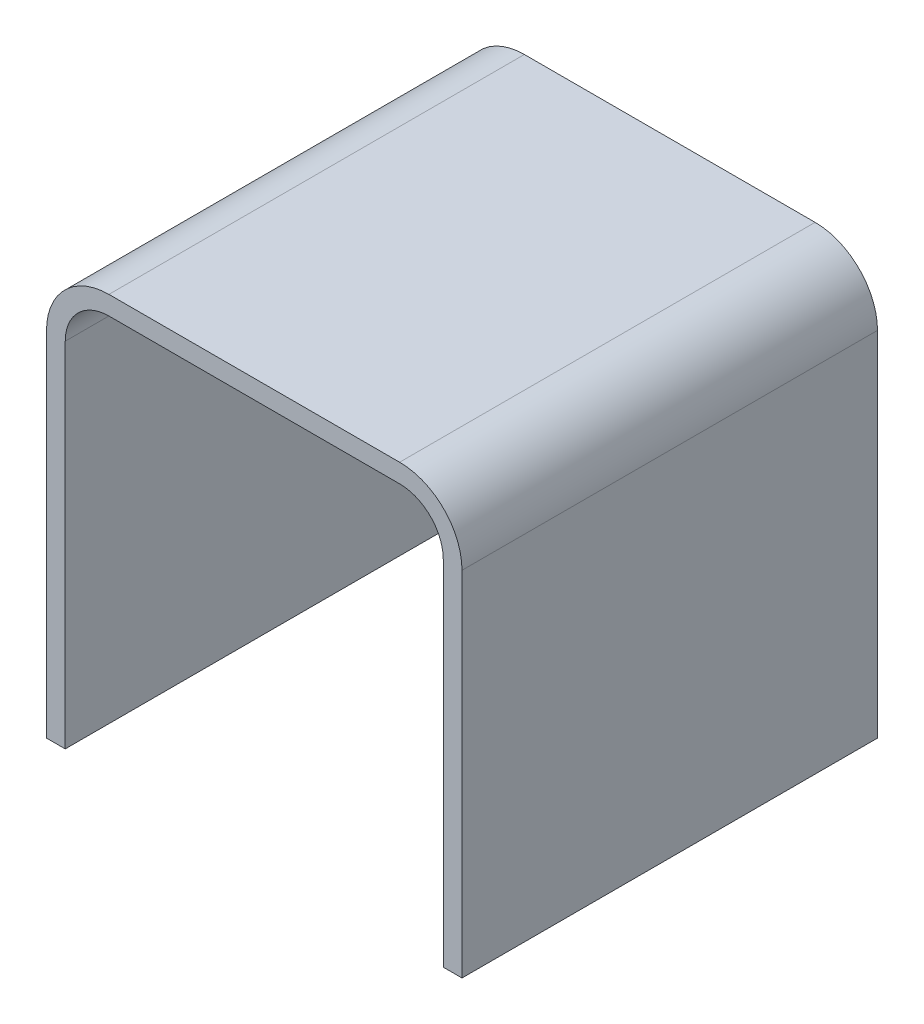
from build123d import *

# Parameters (mm, degrees)
SCHIZZO1_W                   = 66.6
SCHIZZO1_H                   = 66.6
ESTRUSIONE_ESTRUSIONE1_DEPTH = 3
SCHIZZO2_W                   = 3
SCHIZZO2_H                   = 66.6
ESTRUSIONE_ESTRUSIONE2_DEPTH = 63.6
SCHIZZO6_W                   = 60.6
SCHIZZO6_H                   = 3
ESTRUSIONE_ESTRUSIONE4_DEPTH = 63.6
TAGLIO_ESTRUSIONE2_DEPTH     = 66.6
ESTRUSIONE_ESTRUSIONE5_DEPTH = 63.6
SCHIZZO9_R                   = 6
TAGLIO_ESTRUSIONE4_DEPTH     = 94.9479111


with BuildPart() as part:
    # Schizzo1 → Estrusione-Estrusione1 (new body)
    with BuildSketch(Plane.XY):
        Rectangle(SCHIZZO1_W, SCHIZZO1_H)
    extrude(amount=ESTRUSIONE_ESTRUSIONE1_DEPTH)

    # Schizzo2 → Estrusione-Estrusione2 (add)
    with BuildSketch(Plane.XY.offset(3)):
        with Locations((-31.8, 0)):
            Rectangle(SCHIZZO2_W, SCHIZZO2_H)
        with Locations((31.8, 0)):
            Rectangle(SCHIZZO2_W, SCHIZZO2_H)
    extrude(amount=ESTRUSIONE_ESTRUSIONE2_DEPTH)

    # Schizzo6 → Estrusione-Estrusione4 (add)
    with BuildSketch(Plane.XY.offset(3)):
        with Locations((0, 31.8)):
            Rectangle(SCHIZZO6_W, SCHIZZO6_H)
    extrude(amount=ESTRUSIONE_ESTRUSIONE4_DEPTH)

    # Schizzo7 → Taglio-Estrusione2 (cut)
    with BuildSketch(Plane.XY.offset(66.6)):
        with BuildLine():
            Line((-33.3, 23.3), (-33.3, 33.3))
            Line((-33.3, 33.3), (-23.3, 33.3))
            ThreePointArc((-23.3, 33.3), (-30.371067812, 30.371067812), (-33.3, 23.3))
        make_face()
        with BuildLine():
            Line((33.3, 33.3), (33.3, 23.3))
            ThreePointArc((33.3, 23.3), (30.371067812, 30.371067812), (23.3, 33.3))
            Line((23.3, 33.3), (33.3, 33.3))
        make_face()
    extrude(amount=-TAGLIO_ESTRUSIONE2_DEPTH, mode=Mode.SUBTRACT)

    # Schizzo8 → Estrusione-Estrusione5 (add)
    with BuildSketch(Plane.XY.offset(3)):
        with BuildLine():
            Line((-30.3, 23.3), (-30.3, 30.3))
            Line((-30.3, 30.3), (-23.3, 30.3))
            ThreePointArc((-23.3, 30.3), (-28.249747468, 28.249747468), (-30.3, 23.3))
        make_face()
        with BuildLine():
            Line((30.3, 30.3), (30.3, 23.3))
            ThreePointArc((30.3, 23.3), (28.249747468, 28.249747468), (23.3, 30.3))
            Line((23.3, 30.3), (30.3, 30.3))
        make_face()
    extrude(amount=ESTRUSIONE_ESTRUSIONE5_DEPTH)

    # Schizzo9 → Taglio-Estrusione4 (cut, through all)
    with BuildSketch(Plane(origin=(0, 27.3, 3), x_dir=(1, 0, 0), z_dir=(0, 0, 1))):
        with Locations((0, -14.8)):
            Circle(SCHIZZO9_R)
    extrude(amount=-TAGLIO_ESTRUSIONE4_DEPTH, mode=Mode.SUBTRACT)


solid = part.part
